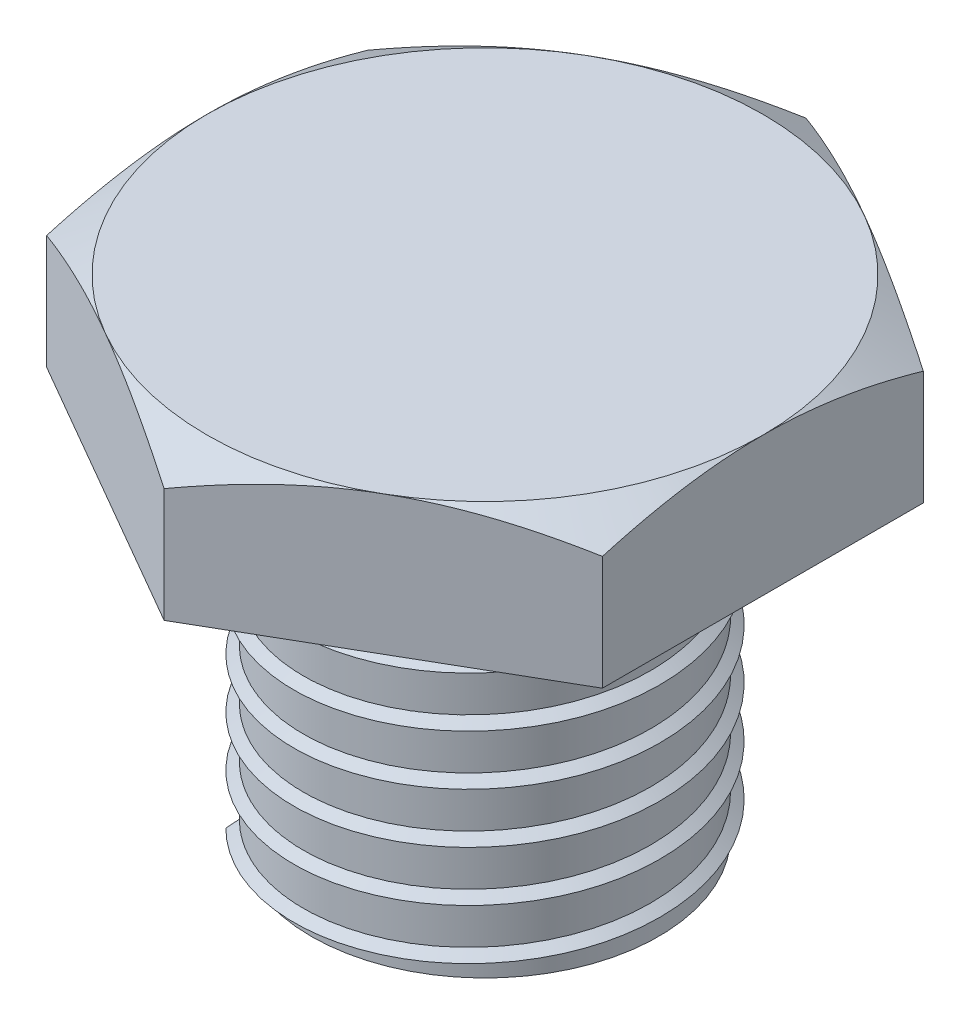
from build123d import *

# Parameters (mm, degrees)
SALIENTE_EXTRUIR1_DEPTH = 5.08
CROQUIS2_OUTSIDE_W      = 33.01
CROQUIS2_OUTSIDE_H      = 36.154
CROQUIS2_OUTSIDE_R      = 10.16
CORTAR_EXTRUIR1_DEPTH   = 1.27
CORTAR_EXTRUIR1_DRAFT   = -60
CROQUIS3_R              = 6.35
SALIENTE_EXTRUIR2_DEPTH = 12.7
BARRER3_PITCH           = 1.84
BARRER3_HEIGHT          = 10.12
BARRER3_RADIUS          = 6.35
BARRER3_START_ANGLE     = -45


with BuildPart() as part:
    # Croquis1 → Saliente-Extruir1 (new body)
    with BuildSketch(Plane(origin=(0, 0, 0), x_dir=(1, 0, 0), z_dir=(0, 1, 0))):
        Polygon((0, 11.73175747), (-10.16, 5.865878735), (-10.16, -5.865878735), (0, -11.73175747), (10.16, -5.865878735), (10.16, 5.865878735), align=None)
    extrude(amount=SALIENTE_EXTRUIR1_DEPTH)


with BuildPart() as cortar_extruir1_tool:
    # Croquis2 outside → Cortar-Extruir1 (with draft: the straight prism first)
    with BuildSketch(Plane(origin=(0, 5.08, 0), x_dir=(1, 0, 0), z_dir=(0, 1, 0))):
        Rectangle(CROQUIS2_OUTSIDE_W, CROQUIS2_OUTSIDE_H)
        Circle(CROQUIS2_OUTSIDE_R, mode=Mode.SUBTRACT)
    extrude(amount=-CORTAR_EXTRUIR1_DEPTH)
    # Cortar-Extruir1: the draft: its side faces are tilted about the plane it starts from
    cortar_extruir1_sides = [cortar_extruir1_tool.faces().sort_by_distance(p)[0] for p in [
        (0, 4.445, 18.077),
        (16.505, 4.445, 0),
        (0, 4.445, -18.077),
        (-16.505, 4.445, 0),
        (-10.16, 4.445, 0),
    ]]
    draft(cortar_extruir1_sides, Plane(origin=(0, 5.08, 0), x_dir=(1, 0, 0), z_dir=(0, 1, 0)), CORTAR_EXTRUIR1_DRAFT)


with BuildPart() as part_1:
    add(part.part)

    # Cortar-Extruir1: cut by cortar_extruir1_tool
    add(cortar_extruir1_tool.part, mode=Mode.SUBTRACT)

    # Croquis3 → Saliente-Extruir2 (add)
    with BuildSketch(Plane.XZ):
        with Locations(Location((0, 0, 0), (0, 0, 90))):
            Circle(CROQUIS3_R)
    extrude(amount=SALIENTE_EXTRUIR2_DEPTH)


with BuildPart() as body_2:
    # Barrer3: sweep along a helix
    with BuildLine() as barrer3_path:
        add(Helix(BARRER3_PITCH, BARRER3_HEIGHT, BARRER3_RADIUS, center=(0, -12.7, 0), direction=(0, 1, 0), mode=Mode.PRIVATE).rotate(Axis((0, -12.7, 0), (0, 1, 0)), BARRER3_START_ANGLE))
    # Croquis5 → Barrer3 (sweep)
    with BuildSketch(Plane(origin=(4.490128061, -2.58, -4.490128061), x_dir=(-0.7048585294194096, 0.04597070738970448, 0.7078567281355724), z_dir=(-0.7063560380101144, 0.04606837454752911, -0.7063560380100127))):
        Polygon((0.000618506, 0.013425832), (0.024021241, 0.521425832), (-0.338054001, 0.267425832), align=None)
    sweep(path=barrer3_path.line, is_frenet=True)


solid = Compound([part_1.part, body_2.part])
